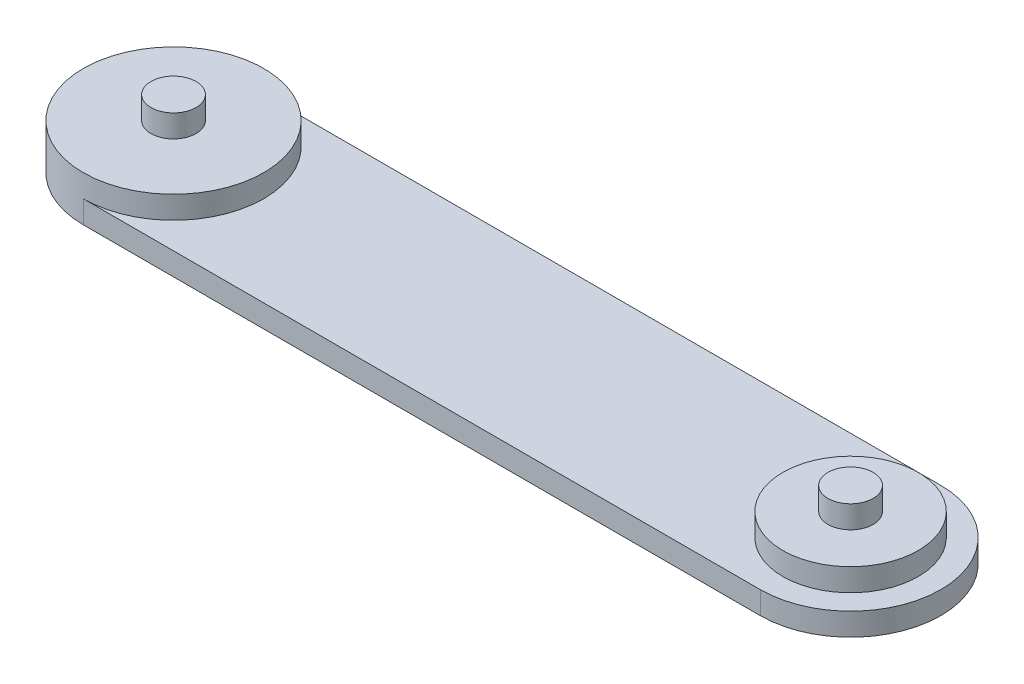
from build123d import *

# Parameters (mm, degrees)
BOSS_EXTRUDE1_DEPTH = 10
SKETCH2_R           = 40
SKETCH2_R_2         = 30
BOSS_EXTRUDE2_DEPTH = 10
SKETCH3_R           = 10
BOSS_EXTRUDE3_DEPTH = 10
CUT_EXTRUDE1_DEPTH  = 2


with BuildPart() as part:
    # Sketch1 → Boss-Extrude1 (new body)
    with BuildSketch(Plane(origin=(0, 0, 0), x_dir=(1, 0, 0), z_dir=(0, 1, 0))):
        with BuildLine():
            Line((-300, 40), (0, 40))
            ThreePointArc((0, 40), (40, 0), (0, -40))
            Line((0, -40), (-300, -40))
            ThreePointArc((-300, -40), (-340, 0), (-300, 40))
        make_face()
    extrude(amount=BOSS_EXTRUDE1_DEPTH)

    # Sketch2 → Boss-Extrude2 (add)
    with BuildSketch(Plane(origin=(0, 10, 0), x_dir=(1, 0, 0), z_dir=(0, 1, 0))):
        with Locations(Location((-300, 0, 0), (0, 0, 270))):
            Circle(SKETCH2_R)
        with Locations(Location((0, 0, 0), (0, 0, 270))):
            Circle(SKETCH2_R_2)
    extrude(amount=BOSS_EXTRUDE2_DEPTH)

    # Sketch3 → Boss-Extrude3 (add)
    with BuildSketch(Plane(origin=(0, 20, 0), x_dir=(1, 0, 0), z_dir=(0, 1, 0))):
        with Locations(Location((0, 0, 0), (0, 0, 270))):
            Circle(SKETCH3_R)
        with Locations(Location((-300, 0, 0), (0, 0, 270))):
            Circle(SKETCH3_R)
    extrude(amount=BOSS_EXTRUDE3_DEPTH)

    # Sketch5 → Cut-Extrude1 (cut)
    with BuildSketch(Plane.XZ):
        with BuildLine():
            Line((-300, 25), (0, 25))
            ThreePointArc((0, 25), (25, 0), (0, -25))
            Line((0, -25), (-300, -25))
            ThreePointArc((-300, -25), (-325, 0), (-300, 25))
        make_face()
    extrude(amount=-CUT_EXTRUDE1_DEPTH, mode=Mode.SUBTRACT)


solid = part.part
